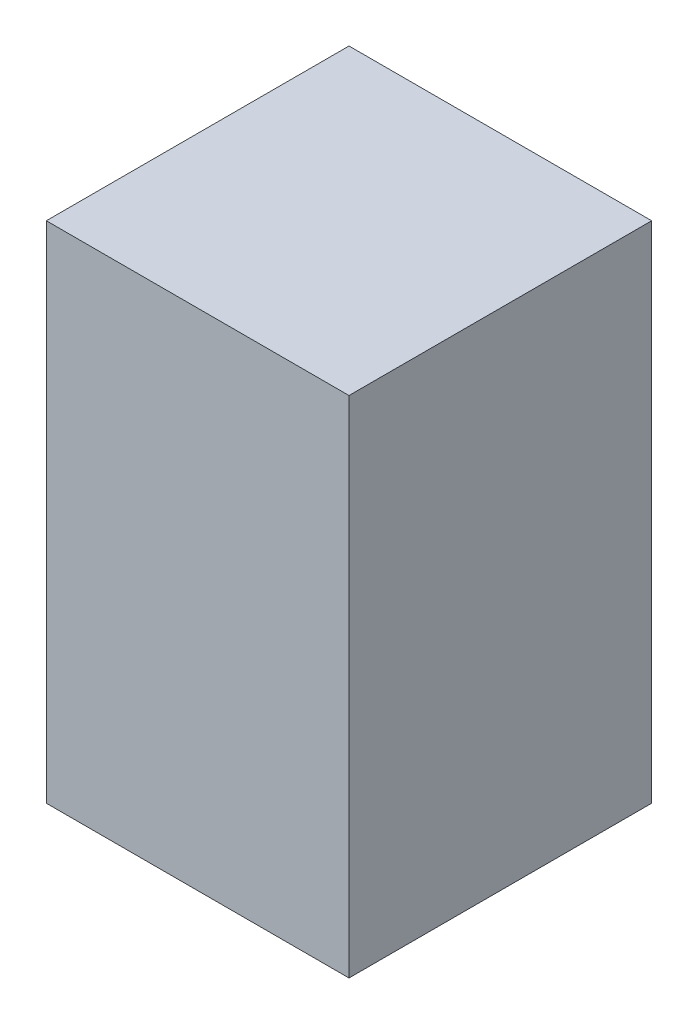
from build123d import *

# Parameters (mm, degrees)
SKETCH1_W           = 3
SKETCH1_H           = 3
BOSS_EXTRUDE1_DEPTH = 5


with BuildPart() as part:
    # Sketch1 → Boss-Extrude1 (new body)
    with BuildSketch(Plane(origin=(0, 0, 0), x_dir=(1, 0, 0), z_dir=(0, 1, 0))):
        Rectangle(SKETCH1_W, SKETCH1_H)
    extrude(amount=BOSS_EXTRUDE1_DEPTH)


solid = part.part
